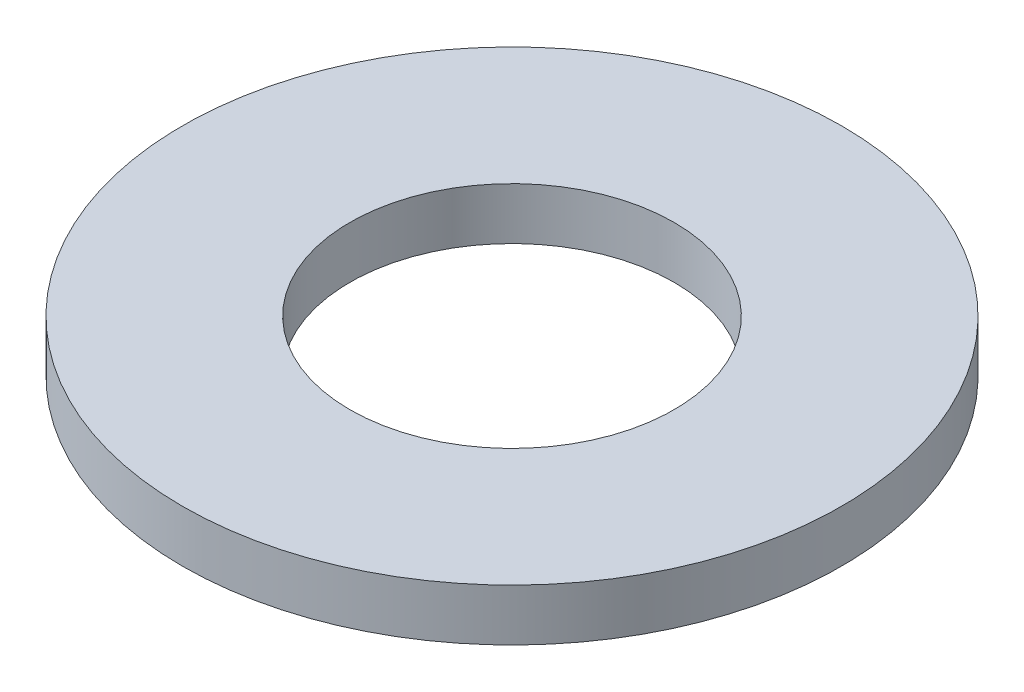
from build123d import *

# Parameters (mm, degrees)
SKETCH2_R           = 76.2
BOSS_EXTRUDE1_DEPTH = 12
SKETCH3_R           = 37.5
CUT_EXTRUDE1_DEPTH  = 109.429147373


with BuildPart() as part:
    # Sketch2 → Boss-Extrude1 (new body)
    with BuildSketch(Plane(origin=(0, 0, 0), x_dir=(1, 0, 0), z_dir=(0, 1, 0))):
        with Locations(Location((0, 0, 0), (0, 0, 270))):
            Circle(SKETCH2_R)
    extrude(amount=BOSS_EXTRUDE1_DEPTH)

    # Sketch3 → Cut-Extrude1 (cut, through all)
    with BuildSketch(Plane(origin=(0, 12, 0), x_dir=(1, 0, 0), z_dir=(0, 1, 0))):
        with Locations(Location((0, 0, 0), (0, 0, 270))):
            Circle(SKETCH3_R)
    extrude(amount=-CUT_EXTRUDE1_DEPTH, mode=Mode.SUBTRACT)


solid = part.part
